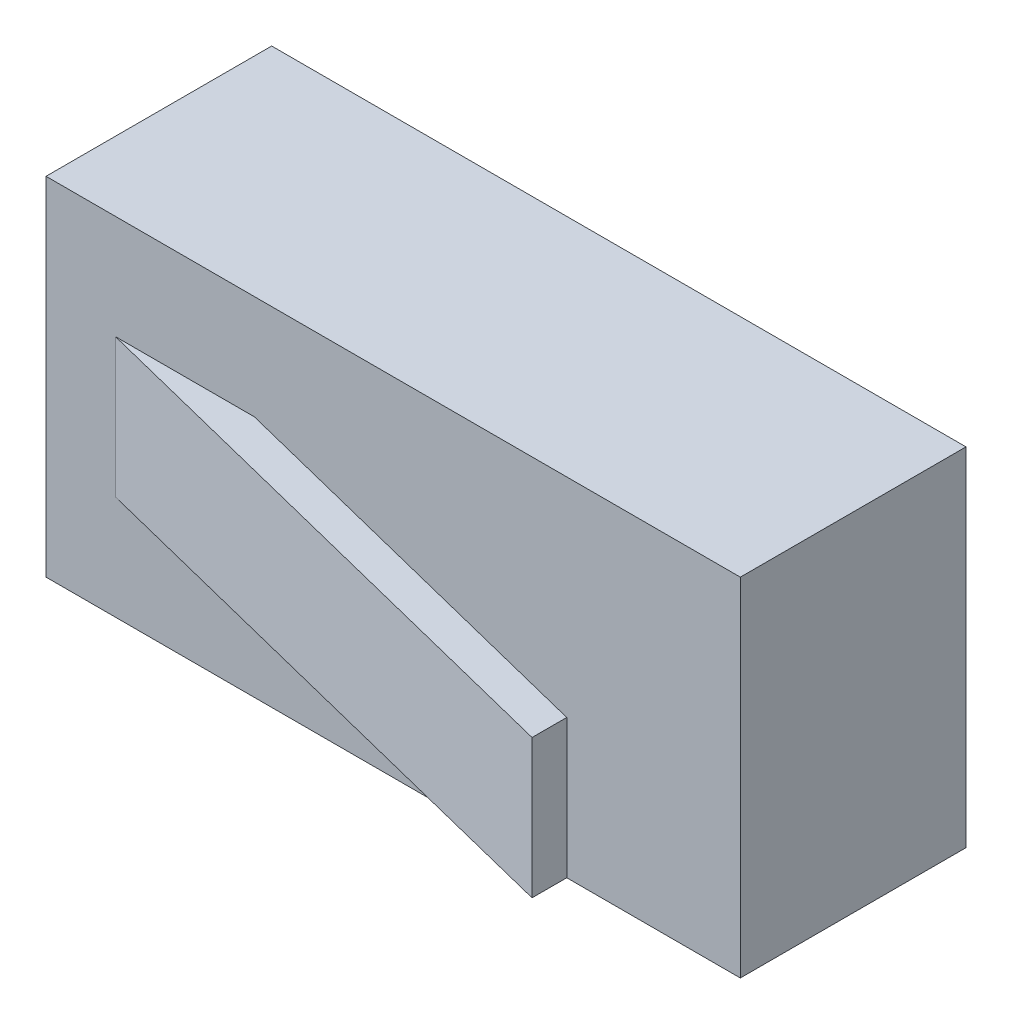
from build123d import *

# Parameters (mm, degrees)
BOITIER_MICROSWITCH_START = -208.5
ESQUISSE1_W               = 20
ESQUISSE1_H               = 10
BOITIER_MICROSWITCH_DEPTH = 6.5
LEVIER_DETECTION_START    = 12
LEVIER_DETECTION_DEPTH    = 4


with BuildPart() as part:
    # Esquisse1 → Boitier_microswitch (new body)
    with BuildSketch(Plane.XY.offset(BOITIER_MICROSWITCH_START)):
        with Locations((0, 14)):
            Rectangle(ESQUISSE1_W, ESQUISSE1_H)
    extrude(amount=-BOITIER_MICROSWITCH_DEPTH)

    # Esquisse2 → Levier_detection (add)
    with BuildSketch(Plane(origin=(0, 0, 0), x_dir=(1, 0, 0), z_dir=(0, 1, 0)).offset(LEVIER_DETECTION_START)):
        Polygon((-8, 208.5), (8, 204.5), (8, 205.5), (-8, 209.5), align=None)
    extrude(amount=LEVIER_DETECTION_DEPTH)


solid = part.part
